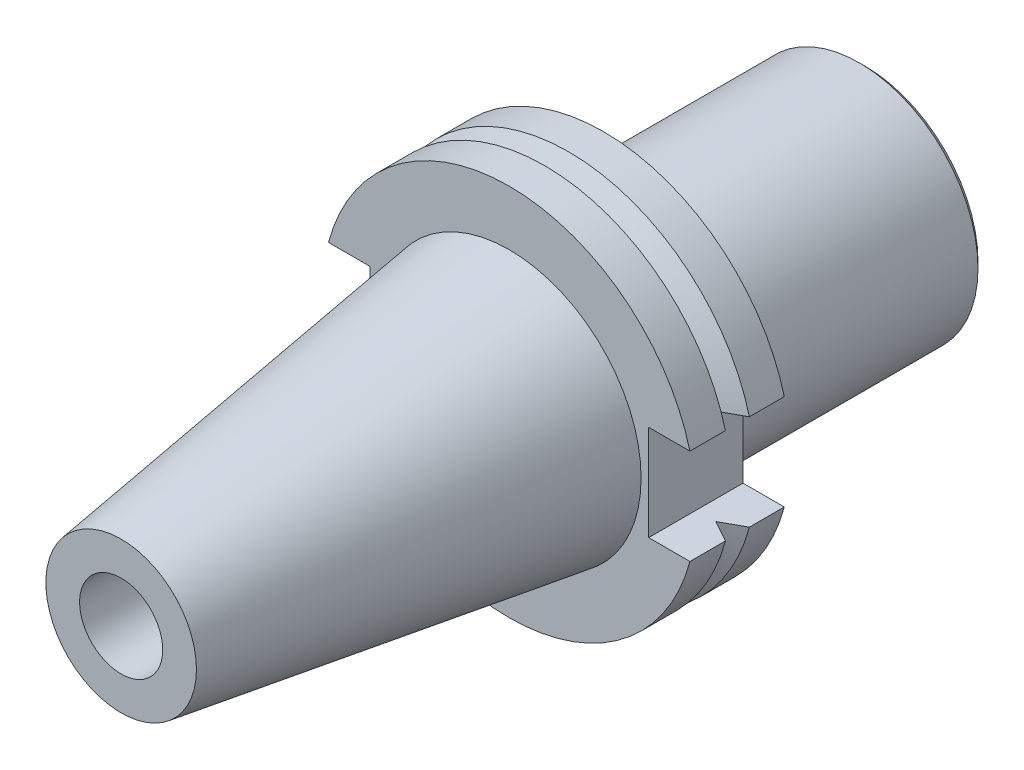
from build123d import *

# Parameters (mm, degrees)
SKETCH_3_W          = 9.5
SKETCH_3_H          = 16.1
CUT_EXTRUDE_1_DEPTH = 80.130651457
SKETCH_4_R          = 4
CUT_EXTRUDE_2_DEPTH = 6
SKETCH_5_R          = 10
CUT_EXTRUDE_3_DEPTH = 50
SKETCH_6_R          = 7
CUT_EXTRUDE_4_DEPTH = 30
SKETCH_7_R          = 3
CUT_EXTRUDE_5_DEPTH = 45.4


with BuildPart() as part:
    # 草图1 → 旋转1 (revolve)
    with BuildSketch(Plane(origin=(0, 0, 0), x_dir=(1, 0, 0), z_dir=(0, 1, 0))):
        Polygon((0, -65.4), (12.6875, -65.4), (22.225, 0), (31.5, 0), (31.5, 15.9), (20, 15.9), (20, 59), (19, 60), (0, 60), align=None)
    revolve(axis=Axis((0, 0, 65.4), (0, 0, -1)))

    # 草图2 → 切除-旋转1 (revolve, cut)
    with BuildSketch(Plane(origin=(0, 0, 0), x_dir=(1, 0, 0), z_dir=(0, 1, 0))):
        Polygon((28, 8), (32, 5.6906), (32, 10.3094), align=None)
    revolve(axis=Axis((0, 0, 0), (0, 0, 1)), mode=Mode.SUBTRACT)

    # 草图3 → 切除-拉伸1 (cut, through all)
    with BuildSketch(Plane.XY):
        with Locations((28.25, 0)):
            Rectangle(SKETCH_3_W, SKETCH_3_H)
        with Locations((-28.25, 0)):
            Rectangle(SKETCH_3_W, SKETCH_3_H)
    extrude(amount=-CUT_EXTRUDE_1_DEPTH, mode=Mode.SUBTRACT)

    # 草图4 → 切除-拉伸2 (cut)
    with BuildSketch(Plane.XY.offset(-15.9)):
        with Locations((0, 25)):
            Circle(SKETCH_4_R)
    extrude(amount=CUT_EXTRUDE_2_DEPTH, mode=Mode.SUBTRACT)

    # 草图5 → 切除-拉伸3 (cut)
    with BuildSketch(Plane.XY.offset(-60)):
        Circle(SKETCH_5_R)
    extrude(amount=CUT_EXTRUDE_3_DEPTH, mode=Mode.SUBTRACT)

    # 草图6 → 切除-拉伸4 (cut)
    with BuildSketch(Plane.XY.offset(65.4)):
        Circle(SKETCH_6_R)
    extrude(amount=-CUT_EXTRUDE_4_DEPTH, mode=Mode.SUBTRACT)

    # 草图7 → 切除-拉伸5 (cut)
    with BuildSketch(Plane.XY.offset(-10)):
        Circle(SKETCH_7_R)
    extrude(amount=CUT_EXTRUDE_5_DEPTH, mode=Mode.SUBTRACT)


solid = part.part
